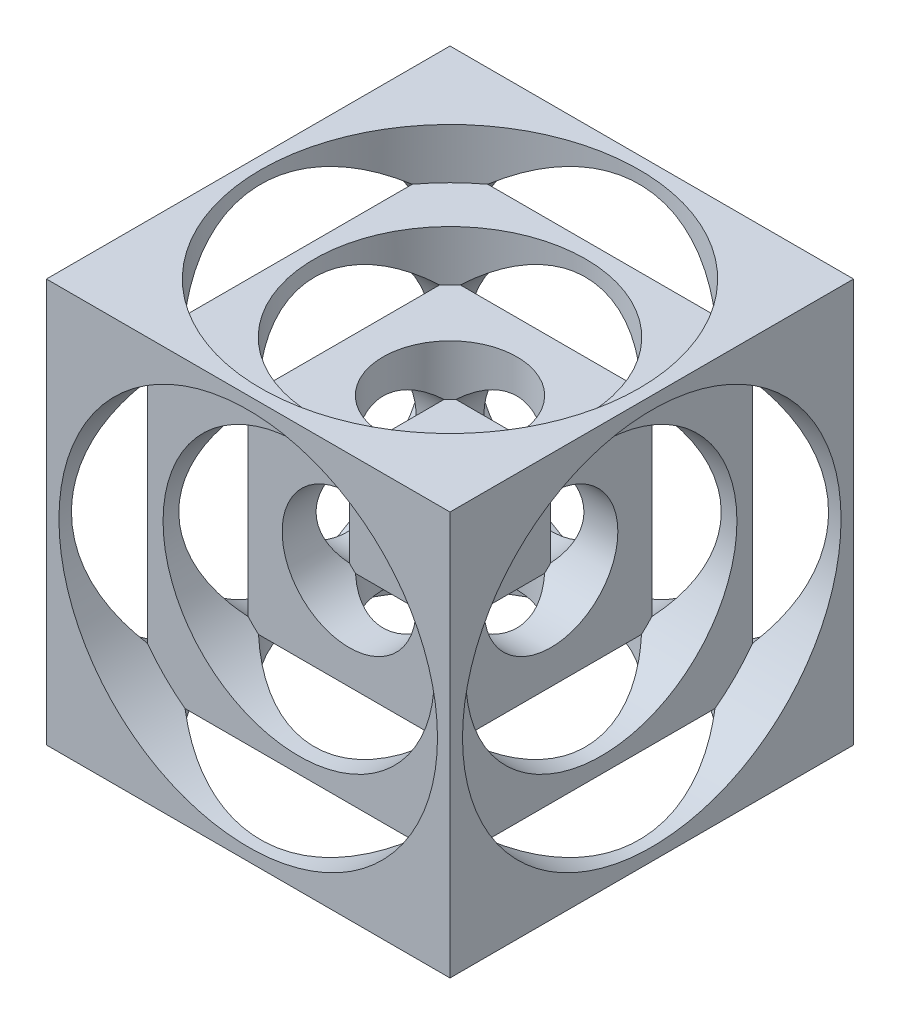
from build123d import *

# Parameters (mm, degrees)
BOSS_EXTRUDE1_DEPTH          = 22.86
BOSS_EXTRUDE1_DEPTH_BACK     = 22.86
SKETCH1_W                    = 45.72
SKETCH1_H                    = 45.72
SKETCH4_R                    = 7.586926628
CUT_EXTRUDE1_DEPTH           = 17.1704
SKETCH5_R                    = 21.442420376
CUT_EXTRUDE2_DEPTH           = 5.715
SKETCH6_R                    = 15.362111806
CUT_EXTRUDE3_DEPTH           = 11.43
CIRPATTERN1_COUNT            = 4
CIRPATTERN2_COPY_1_SKETCH_R  = 7.586926628
CIRPATTERN2_COPY_1_DEPTH     = 17.1704
CIRPATTERN2_COPY_2_SKETCH_R  = 7.586926628
CIRPATTERN2_COPY_2_DEPTH     = 17.1704
CIRPATTERN2_COPY_3_SKETCH_R  = 7.586926628
CIRPATTERN2_COPY_3_DEPTH     = 17.1704
CIRPATTERN2_COPY_4_SKETCH_R  = 21.442420376
CIRPATTERN2_COPY_4_DEPTH     = 5.715
CIRPATTERN2_COPY_5_SKETCH_R  = 21.442420376
CIRPATTERN2_COPY_5_DEPTH     = 5.715
CIRPATTERN2_COPY_6_SKETCH_R  = 21.442420376
CIRPATTERN2_COPY_6_DEPTH     = 5.715
CIRPATTERN2_COPY_7_SKETCH_R  = 15.362111806
CIRPATTERN2_COPY_7_DEPTH     = 11.43
CIRPATTERN2_COPY_8_SKETCH_R  = 15.362111806
CIRPATTERN2_COPY_8_DEPTH     = 11.43
CIRPATTERN2_COPY_9_SKETCH_R  = 15.362111806
CIRPATTERN2_COPY_9_DEPTH     = 11.43
CIRPATTERN2_COPY_10_SKETCH_R = 7.586926628
CIRPATTERN2_COPY_10_DEPTH    = 17.1704
CIRPATTERN2_COPY_11_SKETCH_R = 21.442420376
CIRPATTERN2_COPY_11_DEPTH    = 5.715
CIRPATTERN2_COPY_12_SKETCH_R = 15.362111806
CIRPATTERN2_COPY_12_DEPTH    = 11.43


with BuildPart() as part:
    # Sketch1 → Boss-Extrude1 (new, two sides: drawn at the far end of the back side and taken through both)
    with BuildSketch(Plane.XY.offset(-BOSS_EXTRUDE1_DEPTH_BACK)):
        Rectangle(SKETCH1_W, SKETCH1_H)
    extrude(amount=BOSS_EXTRUDE1_DEPTH + BOSS_EXTRUDE1_DEPTH_BACK)

    # Sketch4 → Cut-Extrude1 (cut)
    with BuildSketch(Plane.XY.offset(22.86)):
        Circle(SKETCH4_R)
    cut_extrude1 = extrude(amount=-CUT_EXTRUDE1_DEPTH, mode=Mode.SUBTRACT)

    # Sketch5 → Cut-Extrude2 (cut)
    with BuildSketch(Plane.XY.offset(22.86)):
        Circle(SKETCH5_R)
    cut_extrude2 = extrude(amount=-CUT_EXTRUDE2_DEPTH, mode=Mode.SUBTRACT)

    # Sketch6 → Cut-Extrude3 (cut)
    with BuildSketch(Plane.XY.offset(22.86)):
        Circle(SKETCH6_R)
    cut_extrude3 = extrude(amount=-CUT_EXTRUDE3_DEPTH, mode=Mode.SUBTRACT)

    # CirPattern1: Cut-Extrude1, Cut-Extrude2, Cut-Extrude3 ×4 about axis
    cirpattern1_axis = Axis((0, -25.146, 0), (0, 1, 0))
    add([cut_extrude1.rotate(cirpattern1_axis, i * 360 / CIRPATTERN1_COUNT) for i in range(1, CIRPATTERN1_COUNT)], mode=Mode.SUBTRACT)
    add([cut_extrude2.rotate(cirpattern1_axis, i * 360 / CIRPATTERN1_COUNT) for i in range(1, CIRPATTERN1_COUNT)], mode=Mode.SUBTRACT)
    add([cut_extrude3.rotate(cirpattern1_axis, i * 360 / CIRPATTERN1_COUNT) for i in range(1, CIRPATTERN1_COUNT)], mode=Mode.SUBTRACT)

    # CirPattern2 copy 1 sketch → CirPattern2 copy 1 (cut)
    with BuildSketch(Plane(origin=(22.86, 0, 0), x_dir=(0, -1, 0), z_dir=(1, 0, 0))):
        Circle(CIRPATTERN2_COPY_1_SKETCH_R)
    extrude(amount=-CIRPATTERN2_COPY_1_DEPTH, mode=Mode.SUBTRACT)

    # CirPattern2 copy 2 sketch → CirPattern2 copy 2 (cut)
    with BuildSketch(Plane(origin=(0, -22.86, 0), x_dir=(-1, 0, 0), z_dir=(0, -1, 0))):
        Circle(CIRPATTERN2_COPY_2_SKETCH_R)
    extrude(amount=-CIRPATTERN2_COPY_2_DEPTH, mode=Mode.SUBTRACT)

    # CirPattern2 copy 3 sketch → CirPattern2 copy 3 (cut)
    with BuildSketch(Plane(origin=(-22.86, 0, 0), x_dir=(0, 1, 0), z_dir=(-1, 0, 0))):
        Circle(CIRPATTERN2_COPY_3_SKETCH_R)
    extrude(amount=-CIRPATTERN2_COPY_3_DEPTH, mode=Mode.SUBTRACT)

    # CirPattern2 copy 4 sketch → CirPattern2 copy 4 (cut)
    with BuildSketch(Plane(origin=(22.86, 0, 0), x_dir=(0, -1, 0), z_dir=(1, 0, 0))):
        Circle(CIRPATTERN2_COPY_4_SKETCH_R)
    extrude(amount=-CIRPATTERN2_COPY_4_DEPTH, mode=Mode.SUBTRACT)

    # CirPattern2 copy 5 sketch → CirPattern2 copy 5 (cut)
    with BuildSketch(Plane(origin=(0, -22.86, 0), x_dir=(-1, 0, 0), z_dir=(0, -1, 0))):
        Circle(CIRPATTERN2_COPY_5_SKETCH_R)
    extrude(amount=-CIRPATTERN2_COPY_5_DEPTH, mode=Mode.SUBTRACT)

    # CirPattern2 copy 6 sketch → CirPattern2 copy 6 (cut)
    with BuildSketch(Plane(origin=(-22.86, 0, 0), x_dir=(0, 1, 0), z_dir=(-1, 0, 0))):
        Circle(CIRPATTERN2_COPY_6_SKETCH_R)
    extrude(amount=-CIRPATTERN2_COPY_6_DEPTH, mode=Mode.SUBTRACT)

    # CirPattern2 copy 7 sketch → CirPattern2 copy 7 (cut)
    with BuildSketch(Plane(origin=(22.86, 0, 0), x_dir=(0, -1, 0), z_dir=(1, 0, 0))):
        Circle(CIRPATTERN2_COPY_7_SKETCH_R)
    extrude(amount=-CIRPATTERN2_COPY_7_DEPTH, mode=Mode.SUBTRACT)

    # CirPattern2 copy 8 sketch → CirPattern2 copy 8 (cut)
    with BuildSketch(Plane(origin=(0, -22.86, 0), x_dir=(-1, 0, 0), z_dir=(0, -1, 0))):
        Circle(CIRPATTERN2_COPY_8_SKETCH_R)
    extrude(amount=-CIRPATTERN2_COPY_8_DEPTH, mode=Mode.SUBTRACT)

    # CirPattern2 copy 9 sketch → CirPattern2 copy 9 (cut)
    with BuildSketch(Plane(origin=(-22.86, 0, 0), x_dir=(0, 1, 0), z_dir=(-1, 0, 0))):
        Circle(CIRPATTERN2_COPY_9_SKETCH_R)
    extrude(amount=-CIRPATTERN2_COPY_9_DEPTH, mode=Mode.SUBTRACT)

    # CirPattern2 copy 10 sketch → CirPattern2 copy 10 (cut)
    with BuildSketch(Plane(origin=(0, 22.86, 0), x_dir=(1, 0, 0), z_dir=(0, 1, 0))):
        Circle(CIRPATTERN2_COPY_10_SKETCH_R)
    extrude(amount=-CIRPATTERN2_COPY_10_DEPTH, mode=Mode.SUBTRACT)

    # CirPattern2 copy 11 sketch → CirPattern2 copy 11 (cut)
    with BuildSketch(Plane(origin=(0, 22.86, 0), x_dir=(1, 0, 0), z_dir=(0, 1, 0))):
        Circle(CIRPATTERN2_COPY_11_SKETCH_R)
    extrude(amount=-CIRPATTERN2_COPY_11_DEPTH, mode=Mode.SUBTRACT)

    # CirPattern2 copy 12 sketch → CirPattern2 copy 12 (cut)
    with BuildSketch(Plane(origin=(0, 22.86, 0), x_dir=(1, 0, 0), z_dir=(0, 1, 0))):
        Circle(CIRPATTERN2_COPY_12_SKETCH_R)
    extrude(amount=-CIRPATTERN2_COPY_12_DEPTH, mode=Mode.SUBTRACT)


solid = part.part
